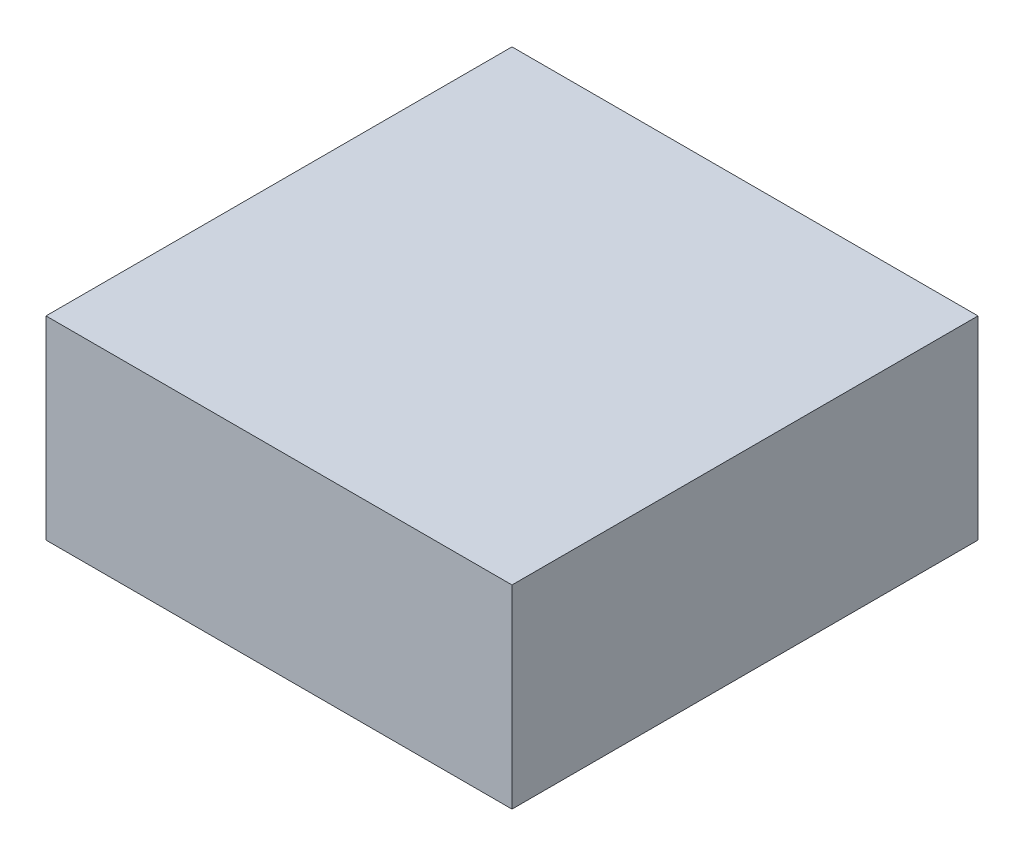
from build123d import *

# Parameters (mm, degrees)
SKETCH1_W           = 38.1
SKETCH1_H           = 38.1
BOSS_EXTRUDE1_DEPTH = 15.875


with BuildPart() as part:
    # Sketch1 → Boss-Extrude1 (new body)
    with BuildSketch(Plane(origin=(0, 0, 0), x_dir=(1, 0, 0), z_dir=(0, 1, 0))):
        Rectangle(SKETCH1_W, SKETCH1_H)
    extrude(amount=BOSS_EXTRUDE1_DEPTH)


solid = part.part
